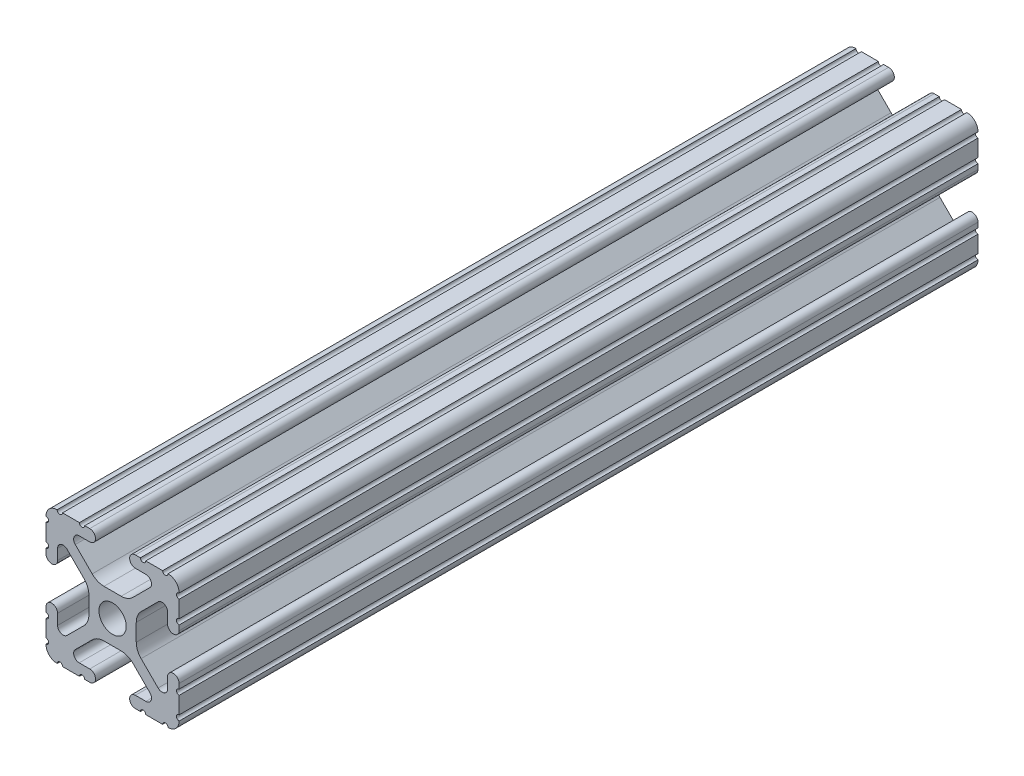
from build123d import *

# Parameters (mm, degrees)
SKETCH1_R      = 2.6035
EXTRUDE1_DEPTH = 152.4


with BuildPart() as part:
    # Sketch1 → Extrude1 (new body)
    with BuildSketch(Plane.XY):
        with BuildLine():
            Line((10.5918, 12.7), (10.5664, 12.7))
            ThreePointArc((10.5664, 12.7), (10.0584, 12.192), (9.5504, 12.7))
            Line((9.5504, 12.7), (6.3246, 12.7))
            ThreePointArc((6.3246, 12.7), (5.8166, 12.192), (5.3086, 12.7))
            Line((5.3086, 12.7), (4.3561, 12.7))
            ThreePointArc((4.3561, 12.7), (3.2512, 11.5951), (4.3561, 10.4902))
            Line((4.3561, 10.4902), (6.370083786, 10.4902))
            ThreePointArc((6.370083786, 10.4902), (7.348856743, 9.836204819), (7.119204175, 8.681663397))
            Line((7.119204175, 8.681663397), (3.88464389, 5.447103113))
            ThreePointArc((3.88464389, 5.447103113), (2.854599758, 4.758849627), (1.63957986, 4.517167143))
            Line((1.63957986, 4.517167143), (-1.63957986, 4.517167143))
            ThreePointArc((-1.63957986, 4.517167143), (-2.854599758, 4.758849627), (-3.88464389, 5.447103113))
            Line((-3.88464389, 5.447103113), (-7.119204175, 8.681663397))
            ThreePointArc((-7.119204175, 8.681663397), (-7.348856743, 9.836204819), (-6.370083786, 10.4902))
            Line((-6.370083786, 10.4902), (-4.3561, 10.4902))
            ThreePointArc((-4.3561, 10.4902), (-3.2512, 11.5951), (-4.3561, 12.7))
            Line((-4.3561, 12.7), (-5.3086, 12.7))
            ThreePointArc((-5.3086, 12.7), (-5.8166, 12.192), (-6.3246, 12.7))
            Line((-6.3246, 12.7), (-9.5504, 12.7))
            ThreePointArc((-9.5504, 12.7), (-10.0584, 12.192), (-10.5664, 12.7))
            Line((-10.5664, 12.7), (-10.5918, 12.7))
            ThreePointArc((-10.5918, 12.7), (-12.082522516, 12.082522516), (-12.7, 10.5918))
            Line((-12.7, 10.5918), (-12.7, 10.5664))
            ThreePointArc((-12.7, 10.5664), (-12.192, 10.0584), (-12.7, 9.5504))
            Line((-12.7, 9.5504), (-12.7, 6.3246))
            ThreePointArc((-12.7, 6.3246), (-12.192, 5.8166), (-12.7, 5.3086))
            Line((-12.7, 5.3086), (-12.7, 4.3561))
            ThreePointArc((-12.7, 4.3561), (-11.5951, 3.2512), (-10.4902, 4.3561))
            Line((-10.4902, 4.3561), (-10.4902, 6.370083786))
            ThreePointArc((-10.4902, 6.370083786), (-9.836204819, 7.348856743), (-8.681663397, 7.119204175))
            Line((-8.681663397, 7.119204175), (-5.447103113, 3.88464389))
            ThreePointArc((-5.447103113, 3.88464389), (-4.758849627, 2.854599758), (-4.517167143, 1.63957986))
            Line((-4.517167143, 1.63957986), (-4.517167143, -1.63957986))
            ThreePointArc((-4.517167143, -1.63957986), (-4.758849627, -2.854599758), (-5.447103113, -3.88464389))
            Line((-5.447103113, -3.88464389), (-8.681663397, -7.119204175))
            ThreePointArc((-8.681663397, -7.119204175), (-9.836204819, -7.348856743), (-10.4902, -6.370083786))
            Line((-10.4902, -6.370083786), (-10.4902, -4.3561))
            ThreePointArc((-10.4902, -4.3561), (-11.5951, -3.2512), (-12.7, -4.3561))
            Line((-12.7, -4.3561), (-12.7, -5.3086))
            ThreePointArc((-12.7, -5.3086), (-12.192, -5.8166), (-12.7, -6.3246))
            Line((-12.7, -6.3246), (-12.7, -9.5504))
            ThreePointArc((-12.7, -9.5504), (-12.192, -10.0584), (-12.7, -10.5664))
            Line((-12.7, -10.5664), (-12.7, -10.5918))
            ThreePointArc((-12.7, -10.5918), (-12.082522516, -12.082522516), (-10.5918, -12.7))
            Line((-10.5918, -12.7), (-10.5664, -12.7))
            ThreePointArc((-10.5664, -12.7), (-10.0584, -12.192), (-9.5504, -12.7))
            Line((-9.5504, -12.7), (-6.3246, -12.7))
            ThreePointArc((-6.3246, -12.7), (-5.8166, -12.192), (-5.3086, -12.7))
            Line((-5.3086, -12.7), (-4.3561, -12.7))
            ThreePointArc((-4.3561, -12.7), (-3.2512, -11.5951), (-4.3561, -10.4902))
            Line((-4.3561, -10.4902), (-6.370083786, -10.4902))
            ThreePointArc((-6.370083786, -10.4902), (-7.348856743, -9.836204819), (-7.119204175, -8.681663397))
            Line((-7.119204175, -8.681663397), (-3.88464389, -5.447103113))
            ThreePointArc((-3.88464389, -5.447103113), (-2.854599758, -4.758849627), (-1.63957986, -4.517167143))
            Line((-1.63957986, -4.517167143), (1.63957986, -4.517167143))
            ThreePointArc((1.63957986, -4.517167143), (2.854599758, -4.758849627), (3.88464389, -5.447103113))
            Line((3.88464389, -5.447103113), (7.119204175, -8.681663397))
            ThreePointArc((7.119204175, -8.681663397), (7.348856743, -9.836204819), (6.370083786, -10.4902))
            Line((6.370083786, -10.4902), (4.3561, -10.4902))
            ThreePointArc((4.3561, -10.4902), (3.2512, -11.5951), (4.3561, -12.7))
            Line((4.3561, -12.7), (5.3086, -12.7))
            ThreePointArc((5.3086, -12.7), (5.8166, -12.192), (6.3246, -12.7))
            Line((6.3246, -12.7), (9.5504, -12.7))
            ThreePointArc((9.5504, -12.7), (10.0584, -12.192), (10.5664, -12.7))
            Line((10.5664, -12.7), (10.5918, -12.7))
            ThreePointArc((10.5918, -12.7), (12.082522516, -12.082522516), (12.7, -10.5918))
            Line((12.7, -10.5918), (12.7, -10.5664))
            ThreePointArc((12.7, -10.5664), (12.192, -10.0584), (12.7, -9.5504))
            Line((12.7, -9.5504), (12.7, -6.3246))
            ThreePointArc((12.7, -6.3246), (12.192, -5.8166), (12.7, -5.3086))
            Line((12.7, -5.3086), (12.7, -4.3561))
            ThreePointArc((12.7, -4.3561), (11.5951, -3.2512), (10.4902, -4.3561))
            Line((10.4902, -4.3561), (10.4902, -6.370083786))
            ThreePointArc((10.4902, -6.370083786), (9.836204819, -7.348856743), (8.681663397, -7.119204175))
            Line((8.681663397, -7.119204175), (5.447103113, -3.88464389))
            ThreePointArc((5.447103113, -3.88464389), (4.758849627, -2.854599758), (4.517167143, -1.63957986))
            Line((4.517167143, -1.63957986), (4.517167143, 1.63957986))
            ThreePointArc((4.517167143, 1.63957986), (4.758849627, 2.854599758), (5.447103113, 3.88464389))
            Line((5.447103113, 3.88464389), (8.681663397, 7.119204175))
            ThreePointArc((8.681663397, 7.119204175), (9.836204819, 7.348856743), (10.4902, 6.370083786))
            Line((10.4902, 6.370083786), (10.4902, 4.3561))
            ThreePointArc((10.4902, 4.3561), (11.5951, 3.2512), (12.7, 4.3561))
            Line((12.7, 4.3561), (12.7, 5.3086))
            ThreePointArc((12.7, 5.3086), (12.192, 5.8166), (12.7, 6.3246))
            Line((12.7, 6.3246), (12.7, 9.5504))
            ThreePointArc((12.7, 9.5504), (12.192, 10.0584), (12.7, 10.5664))
            Line((12.7, 10.5664), (12.7, 10.5918))
            ThreePointArc((12.7, 10.5918), (12.082522516, 12.082522516), (10.5918, 12.7))
        make_face()
        Circle(SKETCH1_R, mode=Mode.SUBTRACT)
    extrude(amount=-EXTRUDE1_DEPTH)


solid = part.part
